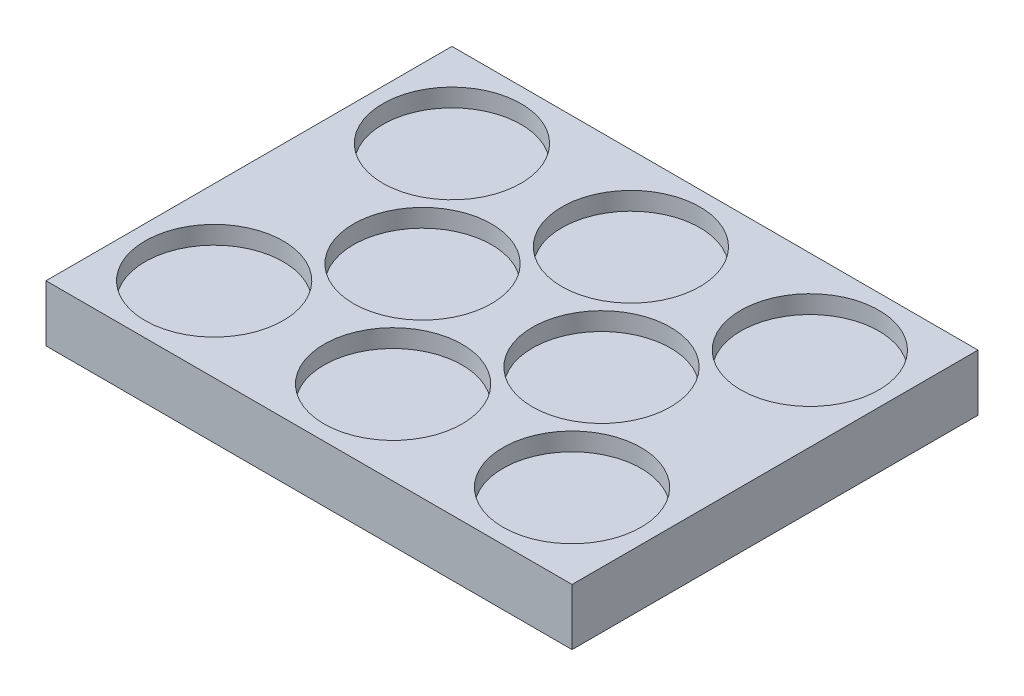
from build123d import *

# Parameters (mm, degrees)
SKETCH_1_W          = 438
SKETCH_1_H          = 338
EXTRUDE_1_DEPTH     = 47
SKETCH_4_R          = 57.5
CUT_EXTRUDE_2_DEPTH = 15


with BuildPart() as part:
    # Эскиз1 → Бобышка-Вытянуть1 (new body)
    with BuildSketch(Plane(origin=(0, 0, 0), x_dir=(1, 0, 0), z_dir=(0, 1, 0))):
        Rectangle(SKETCH_1_W, SKETCH_1_H)
    extrude(amount=EXTRUDE_1_DEPTH)

    # Эскиз4 → Вырез-Вытянуть2 (cut)
    with BuildSketch(Plane(origin=(0, 47, 0), x_dir=(1, 0, 0), z_dir=(0, 1, 0))):
        with Locations(Location((-149, 99, 0), (0, 0, 270))):
            Circle(SKETCH_4_R)
        with Locations(Location((0, 99, 0), (0, 0, 270))):
            Circle(SKETCH_4_R)
        with Locations(Location((0, -99, 0), (0, 0, 270))):
            Circle(SKETCH_4_R)
        with Locations(Location((-149, -99, 0), (0, 0, 270))):
            Circle(SKETCH_4_R)
        with Locations(Location((-74.5, 0, 0), (0, 0, 270))):
            Circle(SKETCH_4_R)
        with Locations(Location((149, 99, 0), (0, 0, 270))):
            Circle(SKETCH_4_R)
        with Locations(Location((149, -99, 0), (0, 0, 270))):
            Circle(SKETCH_4_R)
        with Locations(Location((74.5, 0, 0), (0, 0, 270))):
            Circle(SKETCH_4_R)
    extrude(amount=-CUT_EXTRUDE_2_DEPTH, mode=Mode.SUBTRACT)


solid = part.part
